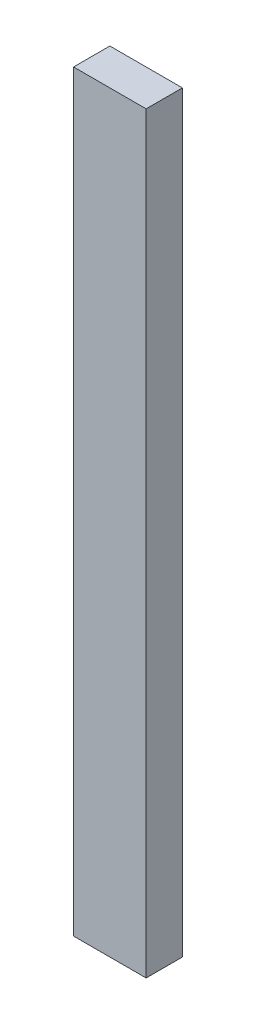
from build123d import *

# Parameters (mm, degrees)
SKETCH1_W           = 25.4
SKETCH1_H           = 12.7
BOSS_EXTRUDE1_DEPTH = 263.525


with BuildPart() as part:
    # Sketch1 → Boss-Extrude1 (new body)
    with BuildSketch(Plane(origin=(0, 0, 0), x_dir=(1, 0, 0), z_dir=(0, 1, 0))):
        with Locations((12.7, 6.35)):
            Rectangle(SKETCH1_W, SKETCH1_H)
    extrude(amount=BOSS_EXTRUDE1_DEPTH)


solid = part.part
